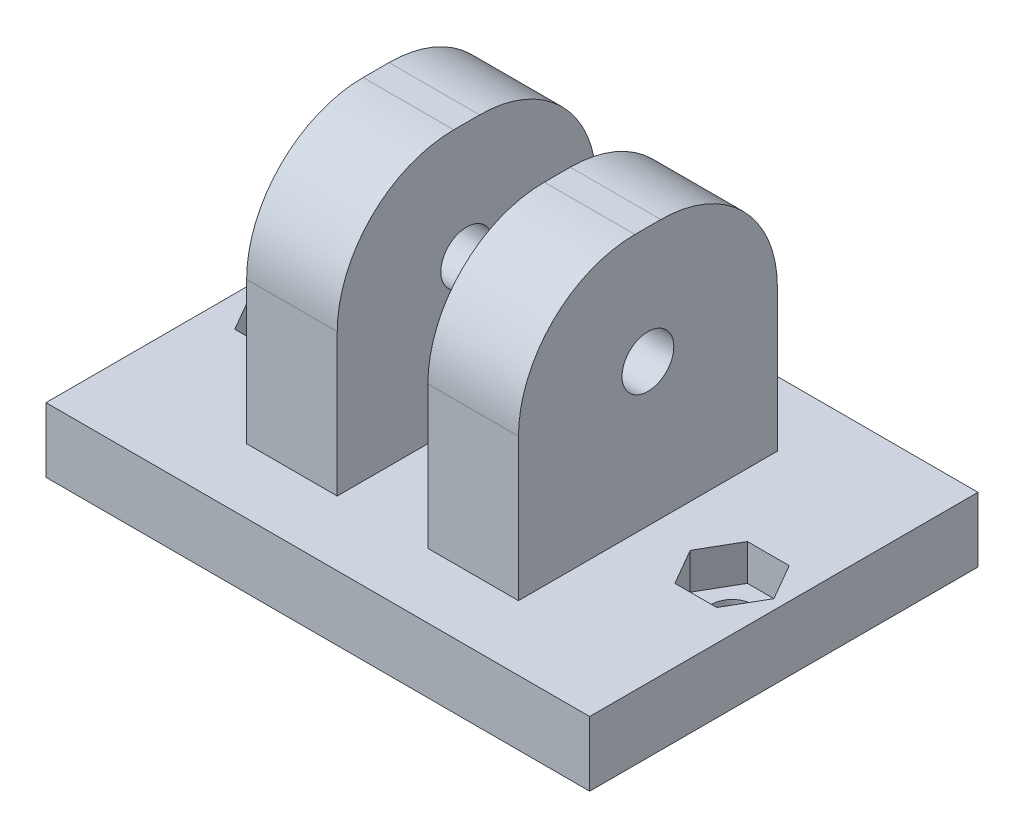
from build123d import *

# Parameters (mm, degrees)
CROQUIS1_W                 = 42
CROQUIS1_H                 = 5
SALIENTE_EXTRUIR1_DEPTH    = 30
CORTAR_EXTRUIR1_DEPTH      = 15
CORTAR_EXTRUIR1_DEPTH_BACK = 21
CROQUIS2_R                 = 1.6
CORTAR_EXTRUIR2_DEPTH      = 2.8
CROQUIS4_W                 = 7
CROQUIS4_H                 = 20
SALIENTE_EXTRUIR2_DEPTH    = 20
REDONDEO1_R                = 9
CORTAR_EXTRUIR3_DEPTH      = 11
CORTAR_EXTRUIR3_DEPTH_BACK = 23
CROQUIS5_R                 = 2


with BuildPart() as part:
    # Croquis1 → Saliente-Extruir1 (new body)
    with BuildSketch(Plane.XY):
        with Locations((0, 2.5)):
            Rectangle(CROQUIS1_W, CROQUIS1_H)
    extrude(amount=SALIENTE_EXTRUIR1_DEPTH)

    # Croquis2 → Cortar-Extruir1 (cut, two sides: drawn at the far end of the back side and taken through both)
    with BuildSketch(Plane(origin=(0, 5, 0), x_dir=(1, 0, 0), z_dir=(0, 1, 0)).offset(-CORTAR_EXTRUIR1_DEPTH_BACK)):
        with Locations((-17, -15)):
            Circle(CROQUIS2_R)
        with Locations((17, -15)):
            Circle(CROQUIS2_R)
    extrude(amount=CORTAR_EXTRUIR1_DEPTH + CORTAR_EXTRUIR1_DEPTH_BACK, mode=Mode.SUBTRACT)

    # Croquis3 → Cortar-Extruir2 (cut)
    with BuildSketch(Plane(origin=(0, 5, 0), x_dir=(1, 0, 0), z_dir=(0, 1, 0))):
        Polygon((15.383419246, -17.8), (13.766838493, -15), (15.383419246, -12.2), (18.616580754, -12.2), (20.233161507, -15), (18.616580754, -17.8), align=None)
        Polygon((-13.766838493, -15), (-15.383419246, -12.2), (-18.616580754, -12.2), (-20.233161507, -15), (-18.616580754, -17.8), (-15.383419246, -17.8), align=None)
    extrude(amount=-CORTAR_EXTRUIR2_DEPTH, mode=Mode.SUBTRACT)

    # Croquis4 → Saliente-Extruir2 (add)
    with BuildSketch(Plane(origin=(0, 5, 0), x_dir=(1, 0, 0), z_dir=(0, 1, 0))):
        with Locations((-7, -15)):
            Rectangle(CROQUIS4_W, CROQUIS4_H)
        with Locations((7, -15)):
            Rectangle(CROQUIS4_W, CROQUIS4_H)
    extrude(amount=SALIENTE_EXTRUIR2_DEPTH)

    # Redondeo1
    redondeo1_edges = [part.edges().sort_by_distance(p)[0] for p in [
        (7, 25, 5),
        (7, 25, 25),
        (-7, 25, 25),
        (-7, 25, 5),
    ]]
    fillet(redondeo1_edges, radius=REDONDEO1_R)

    # Croquis5 → Cortar-Extruir3 (cut, two sides: drawn at the far end of the back side and taken through both)
    with BuildSketch(Plane(origin=(10.5, 0, 0), x_dir=(0, 0, -1), z_dir=(1, 0, 0)).offset(-CORTAR_EXTRUIR3_DEPTH_BACK)):
        with Locations(Location((-15, 16, 0), (0, 0, 180))):
            Circle(CROQUIS5_R)
    extrude(amount=CORTAR_EXTRUIR3_DEPTH + CORTAR_EXTRUIR3_DEPTH_BACK, mode=Mode.SUBTRACT)


solid = part.part
